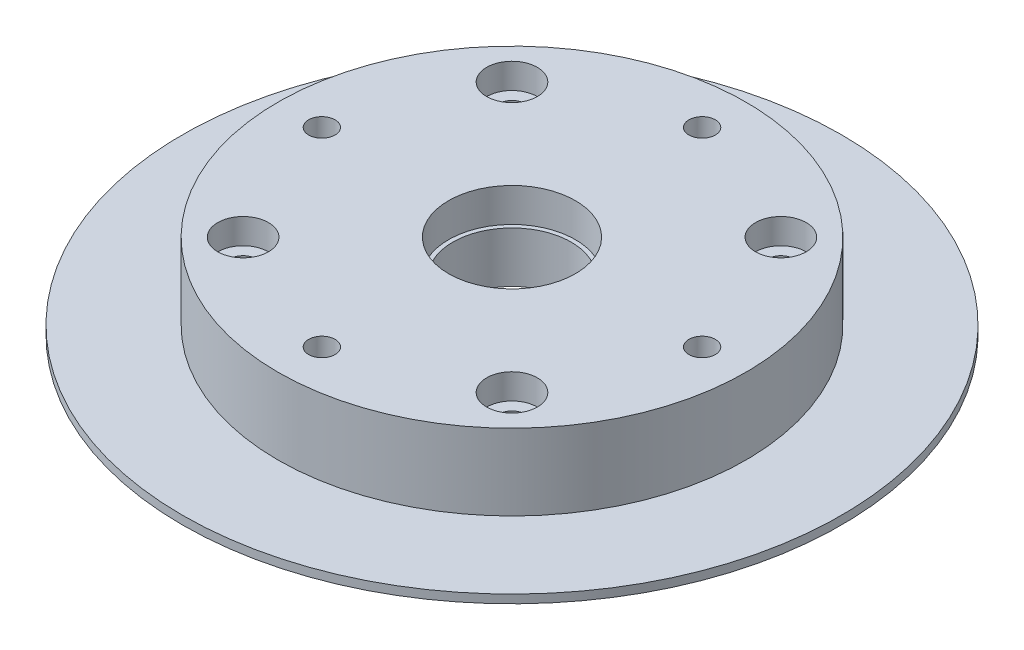
from build123d import *

# Parameters (mm, degrees)
SKETCH1_R           = 39
SKETCH1_R_2         = 1.5635
SKETCH1_R_3         = 7.5
BOSS_EXTRUDE1_DEPTH = 1
BOSS_EXTRUDE2_START = 9
SKETCH1_3_R         = 27.69
SKETCH1_3_R_2       = 1.5635
SKETCH1_3_R_3       = 7.5
BOSS_EXTRUDE2_DEPTH = 9
SKETCH2_R           = 3
SKETCH2_R_2         = 1.5635
CUT_EXTRUDE1_DEPTH  = 3
SKETCH1_4_R         = 7.5
SKETCH1_4_R_2       = 7
BOSS_EXTRUDE3_DEPTH = 1
BOSS_EXTRUDE4_START = 5
SKETCH1_5_R         = 7.5
SKETCH1_5_R_2       = 7
BOSS_EXTRUDE4_DEPTH = 5
SKETCH3_R           = 1.925
CUT_EXTRUDE2_DEPTH  = 4


with BuildPart() as part:
    # Sketch1 → Boss-Extrude1 (new body)
    with BuildSketch(Plane(origin=(0, 0, 0), x_dir=(1, 0, 0), z_dir=(0, 1, 0))):
        Circle(SKETCH1_R)
        with Locations((22.5, 0)):
            Circle(SKETCH1_R_2, mode=Mode.SUBTRACT)
        with Locations((-15.909902577, -15.909902577)):
            Circle(SKETCH1_R_2, mode=Mode.SUBTRACT)
        with Locations((0, -22.5)):
            Circle(SKETCH1_R_2, mode=Mode.SUBTRACT)
        with Locations((15.909902577, -15.909902577)):
            Circle(SKETCH1_R_2, mode=Mode.SUBTRACT)
        with Locations((-22.5, 0)):
            Circle(SKETCH1_R_2, mode=Mode.SUBTRACT)
        with Locations((-15.909902577, 15.909902577)):
            Circle(SKETCH1_R_2, mode=Mode.SUBTRACT)
        with Locations((0, 22.5)):
            Circle(SKETCH1_R_2, mode=Mode.SUBTRACT)
        Circle(SKETCH1_R_3, mode=Mode.SUBTRACT)
        with Locations((15.909902577, 15.909902577)):
            Circle(SKETCH1_R_2, mode=Mode.SUBTRACT)
    extrude(amount=-BOSS_EXTRUDE1_DEPTH)

    # Sketch1<3> → Boss-Extrude2 (add)
    with BuildSketch(Plane(origin=(0, 0, 0), x_dir=(1, 0, 0), z_dir=(0, 1, 0)).offset(BOSS_EXTRUDE2_START)):
        Circle(SKETCH1_3_R)
        with Locations((-15.909902577, -15.909902577)):
            Circle(SKETCH1_3_R_2, mode=Mode.SUBTRACT)
        with Locations((0, -22.5)):
            Circle(SKETCH1_3_R_2, mode=Mode.SUBTRACT)
        with Locations((15.909902577, -15.909902577)):
            Circle(SKETCH1_3_R_2, mode=Mode.SUBTRACT)
        with Locations((-22.5, 0)):
            Circle(SKETCH1_3_R_2, mode=Mode.SUBTRACT)
        with Locations((-15.909902577, 15.909902577)):
            Circle(SKETCH1_3_R_2, mode=Mode.SUBTRACT)
        with Locations((0, 22.5)):
            Circle(SKETCH1_3_R_2, mode=Mode.SUBTRACT)
        Circle(SKETCH1_3_R_3, mode=Mode.SUBTRACT)
        with Locations((15.909902577, 15.909902577)):
            Circle(SKETCH1_3_R_2, mode=Mode.SUBTRACT)
        with Locations((22.5, 0)):
            Circle(SKETCH1_3_R_2, mode=Mode.SUBTRACT)
    extrude(amount=-BOSS_EXTRUDE2_DEPTH)

    # Sketch2 → Cut-Extrude1 (cut)
    # profile 1 of 4: a face of its own
    with BuildSketch(Plane(origin=(0, 9, 0), x_dir=(1, 0, 0), z_dir=(0, 1, 0))):
        with Locations((15.909902577, 15.909902577)):
            Circle(SKETCH2_R)
        with Locations((15.909902577, 15.909902577)):
            Circle(SKETCH2_R_2, mode=Mode.SUBTRACT)
    # profile 2 of 4: a face of its own
    with BuildSketch(Plane(origin=(0, 9, 0), x_dir=(1, 0, 0), z_dir=(0, 1, 0))):
        with Locations((15.909902577, -15.909902577)):
            Circle(SKETCH2_R)
    # profile 3 of 4: a face of its own
    with BuildSketch(Plane(origin=(0, 9, 0), x_dir=(1, 0, 0), z_dir=(0, 1, 0))):
        with Locations((-15.909902577, -15.909902577)):
            Circle(SKETCH2_R)
        with Locations((-15.909902577, -15.909902577)):
            Circle(SKETCH2_R_2, mode=Mode.SUBTRACT)
    # profile 4 of 4: a face of its own
    with BuildSketch(Plane(origin=(0, 9, 0), x_dir=(1, 0, 0), z_dir=(0, 1, 0))):
        with Locations((-15.909902577, 15.909902577)):
            Circle(SKETCH2_R)
        with Locations((-15.909902577, 15.909902577)):
            Circle(SKETCH2_R_2, mode=Mode.SUBTRACT)
    extrude(amount=-CUT_EXTRUDE1_DEPTH, mode=Mode.SUBTRACT)

    # Sketch1<4> → Boss-Extrude3 (add)
    with BuildSketch(Plane(origin=(0, 0, 0), x_dir=(1, 0, 0), z_dir=(0, 1, 0))):
        Circle(SKETCH1_4_R)
        Circle(SKETCH1_4_R_2, mode=Mode.SUBTRACT)
    extrude(amount=-BOSS_EXTRUDE3_DEPTH)

    # Sketch1<5> → Boss-Extrude4 (add)
    with BuildSketch(Plane(origin=(0, 0, 0), x_dir=(1, 0, 0), z_dir=(0, 1, 0)).offset(BOSS_EXTRUDE4_START)):
        Circle(SKETCH1_5_R)
        Circle(SKETCH1_5_R_2, mode=Mode.SUBTRACT)
    extrude(amount=-BOSS_EXTRUDE4_DEPTH)

    # Sketch3 → Cut-Extrude2 (cut)
    with BuildSketch(Plane.XZ.offset(1)):
        with Locations((22.5, 0)):
            Circle(SKETCH3_R)
        with Locations((0, -22.5)):
            Circle(SKETCH3_R)
        with Locations((-22.5, 0)):
            Circle(SKETCH3_R)
        with Locations((0, 22.5)):
            Circle(SKETCH3_R)
    extrude(amount=-CUT_EXTRUDE2_DEPTH, mode=Mode.SUBTRACT)


solid = part.part
